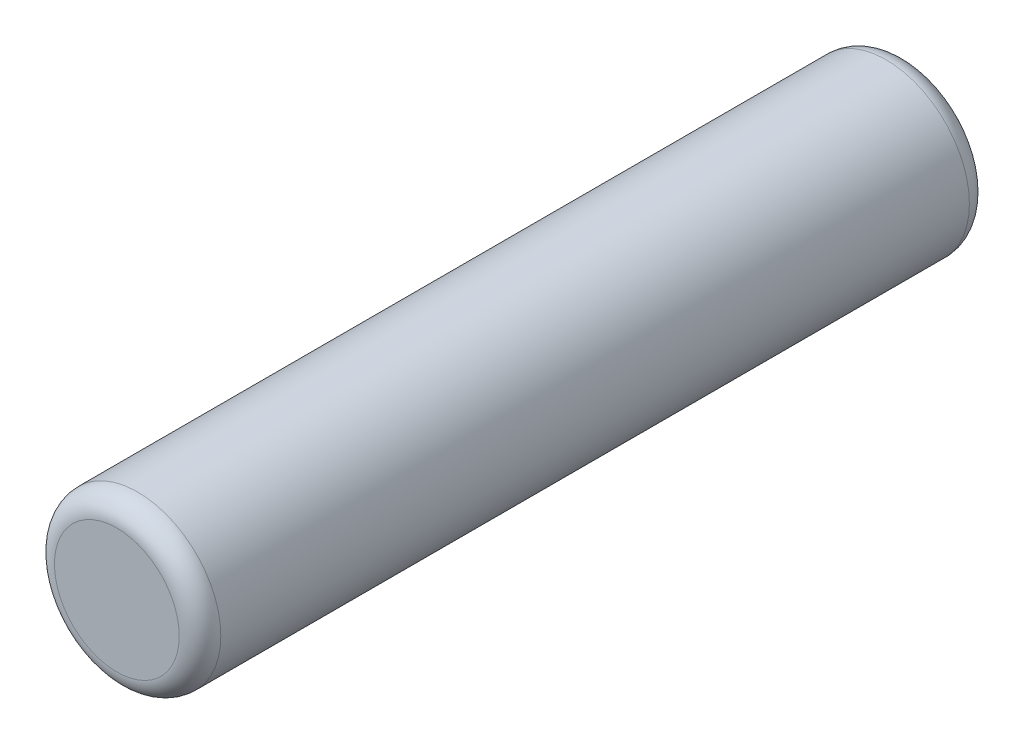
from build123d import *

# Parameters (mm, degrees)
SKETCH1_R           = 2
BOSS_EXTRUDE1_DEPTH = 19
FILLET1_R           = 0.5
FILLET2_R           = 0.5


with BuildPart() as part:
    # Sketch1 → Boss-Extrude1 (new body)
    with BuildSketch(Plane.XY):
        Circle(SKETCH1_R)
    extrude(amount=-BOSS_EXTRUDE1_DEPTH)

    # Fillet1
    fillet1_edges = [part.edges().sort_by_distance(p)[0] for p in [
        (-2, 0, -19),
    ]]
    fillet(fillet1_edges, radius=FILLET1_R)

    # Fillet2
    fillet2_edges = [part.edges().sort_by_distance(p)[0] for p in [
        (-2, 0, 0),
    ]]
    fillet(fillet2_edges, radius=FILLET2_R)


solid = part.part
